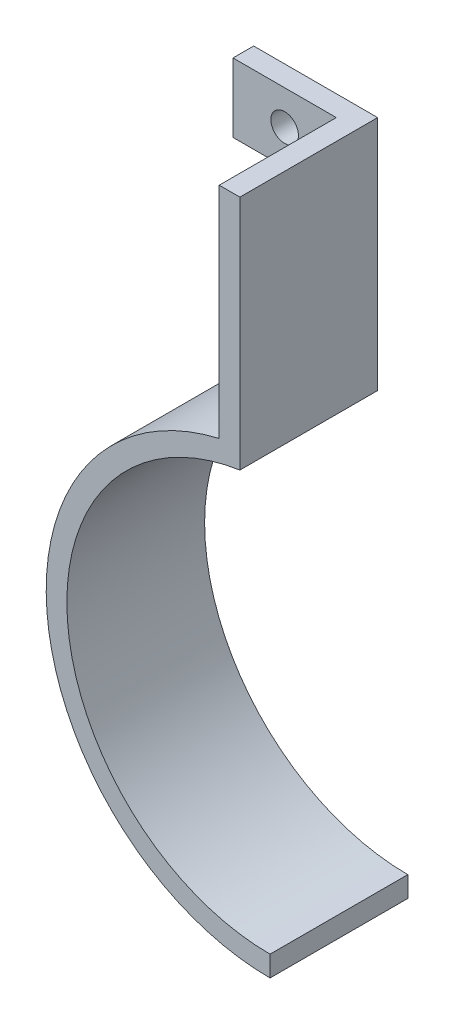
from build123d import *

# Parameters (mm, degrees)
BOSS_EXTRUDE1_DEPTH             = 20
SKETCH3_W                       = 3
SKETCH3_H                       = 20
BOSS_EXTRUDE3_DEPTH             = 31
BOSS_EXTRUDE3_DIRECTION_2_REACH = 77.374
SKETCH4_W                       = 3
SKETCH4_H                       = 10
BOSS_EXTRUDE4_DEPTH             = 15
SKETCH6_R                       = 2
CUT_EXTRUDE2_DEPTH              = 3


with BuildPart() as part:
    # Sketch1 → Boss-Extrude1 (new body)
    with BuildSketch(Plane.XY):
        with BuildLine():
            Line((0, -29.5), (0, -32.5))
            ThreePointArc((0, -32.5), (-32.4258356, -2.194353132), (-4.378691316, 32.203680882))
            Line((-4.378691316, 32.203680882), (-4.378691316, 29.173225093))
            ThreePointArc((-4.378691316, 29.173225093), (-29.418192843, -2.195433869), (0, -29.5))
        make_face()
    extrude(amount=BOSS_EXTRUDE1_DEPTH)

    # Sketch3 → Boss-Extrude3 (add)
    with BuildSketch(Plane(origin=(0, 32.5, 0), x_dir=(1, 0, 0), z_dir=(0, 1, 0))):
        with Locations((-5.878691316, -10)):
            Rectangle(SKETCH3_W, SKETCH3_H)
    extrude(amount=BOSS_EXTRUDE3_DEPTH)

    # Sketch3 → Boss-Extrude3 direction 2 (add, up to next)
    with BuildSketch(Plane(origin=(0, 32.5, 0), x_dir=(1, 0, 0), z_dir=(0, 1, 0)), mode=Mode.PRIVATE) as boss_extrude3_direction_2_sk1:
        with Locations((-5.878691316, -10)):
            Rectangle(SKETCH3_W, SKETCH3_H)
    boss_extrude3_direction_2_tool1 = extrude(boss_extrude3_direction_2_sk1.sketch, amount=-BOSS_EXTRUDE3_DIRECTION_2_REACH, mode=Mode.PRIVATE) - part.part
    add(boss_extrude3_direction_2_tool1.solids().sort_by_distance((-5.878691, 32.5, 10))[0])

    # Sketch4 → Boss-Extrude4 (add)
    with BuildSketch(Plane.ZY.offset(7.378691316)):
        with Locations((1.5, 58.5)):
            Rectangle(SKETCH4_W, SKETCH4_H)
    extrude(amount=BOSS_EXTRUDE4_DEPTH)

    # Sketch6 → Cut-Extrude2 (cut)
    with BuildSketch(Plane.XY.offset(3)):
        with Locations((-14.878691316, 58.5)):
            Circle(SKETCH6_R)
    extrude(amount=-CUT_EXTRUDE2_DEPTH, mode=Mode.SUBTRACT)


solid = part.part
